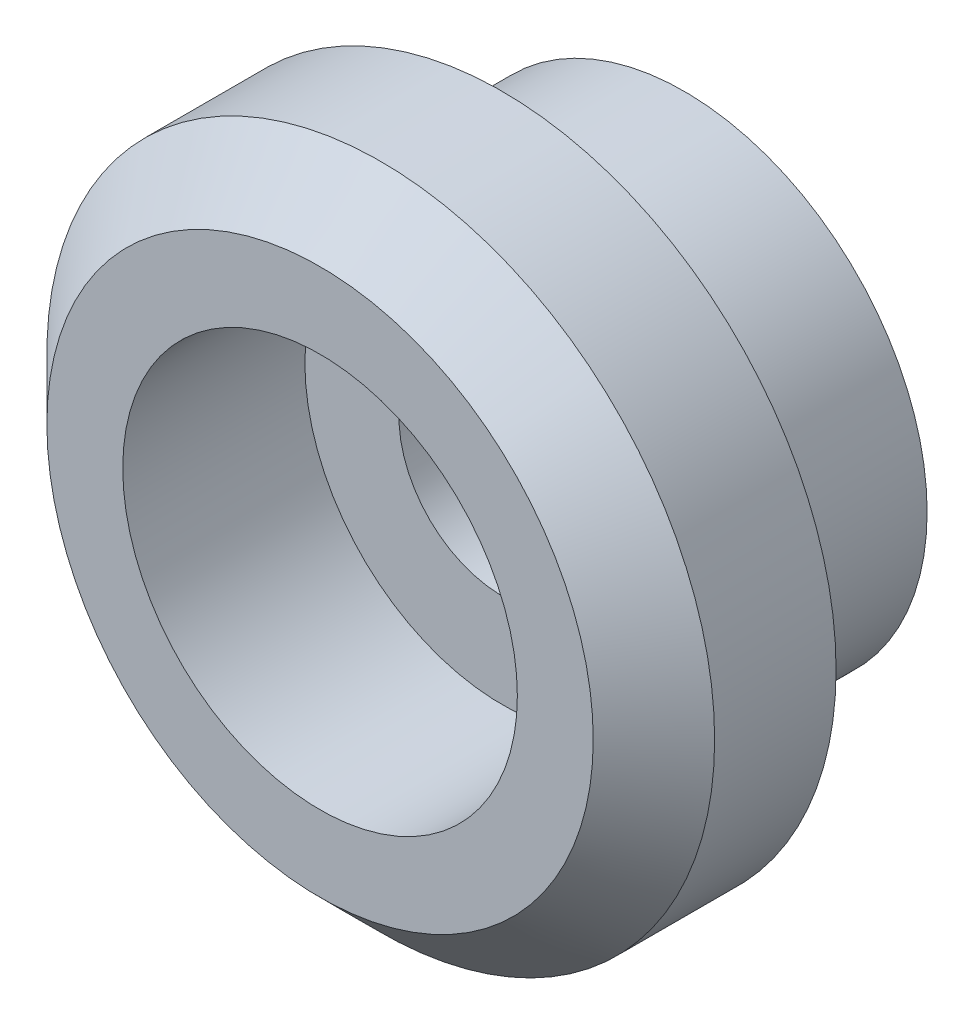
from build123d import *

# Parameters (mm, degrees)
SKETCH1_R                      = 4
BOSS_EXTRUDE1_DEPTH            = 3
SKETCH2_R                      = 5.5
BOSS_EXTRUDE2_DEPTH            = 3
CBORE_FOR_M3_SHCS1_D           = 3.4
CBORE_FOR_M3_SHCS1_CBORE_D     = 6.5
CBORE_FOR_M3_SHCS1_CBORE_DEPTH = 3
CHAMFER1_SIZE                  = 1


with BuildPart() as part:
    # Sketch1 → Boss-Extrude1 (new body)
    with BuildSketch(Plane.XY):
        Circle(SKETCH1_R)
    extrude(amount=BOSS_EXTRUDE1_DEPTH)

    # Sketch2 → Boss-Extrude2 (add)
    with BuildSketch(Plane.XY.offset(3)):
        Circle(SKETCH2_R)
    extrude(amount=BOSS_EXTRUDE2_DEPTH)

    # CBORE for M3 SHCS1 (through all)
    with Locations(Plane.XY.offset(6)):
        with Locations((0, 0)):
            CounterBoreHole(CBORE_FOR_M3_SHCS1_D / 2, CBORE_FOR_M3_SHCS1_CBORE_D / 2, CBORE_FOR_M3_SHCS1_CBORE_DEPTH)

    # Chamfer1
    chamfer1_edges = [part.edges().sort_by_distance(p)[0] for p in [
        (-5.5, 0, 6),
    ]]
    chamfer(chamfer1_edges, length=CHAMFER1_SIZE)


solid = part.part
